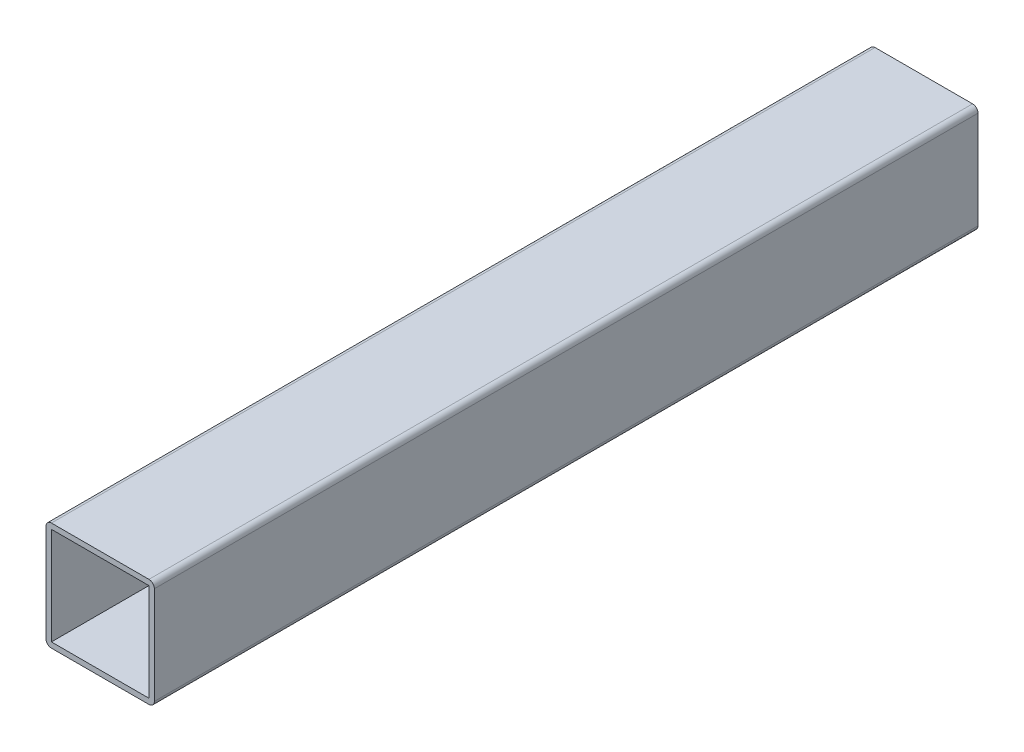
from build123d import *

# Parameters (mm, degrees)
SKETCH1_W           = 90
SKETCH1_H           = 90
BOSS_EXTRUDE1_DEPTH = 760


with BuildPart() as part:
    # Sketch1 → Boss-Extrude1 (new body)
    with BuildSketch(Plane.XY):
        with BuildLine():
            Line((-45, -50), (45, -50))
            ThreePointArc((45, -50), (48.535533906, -48.535533906), (50, -45))
            Line((50, -45), (50, 45))
            ThreePointArc((50, 45), (48.535533906, 48.535533906), (45, 50))
            Line((45, 50), (-45, 50))
            ThreePointArc((-45, 50), (-48.535533906, 48.535533906), (-50, 45))
            Line((-50, 45), (-50, -45))
            ThreePointArc((-50, -45), (-48.535533906, -48.535533906), (-45, -50))
        make_face()
        Rectangle(SKETCH1_W, SKETCH1_H, mode=Mode.SUBTRACT)
    extrude(amount=BOSS_EXTRUDE1_DEPTH)


solid = part.part
